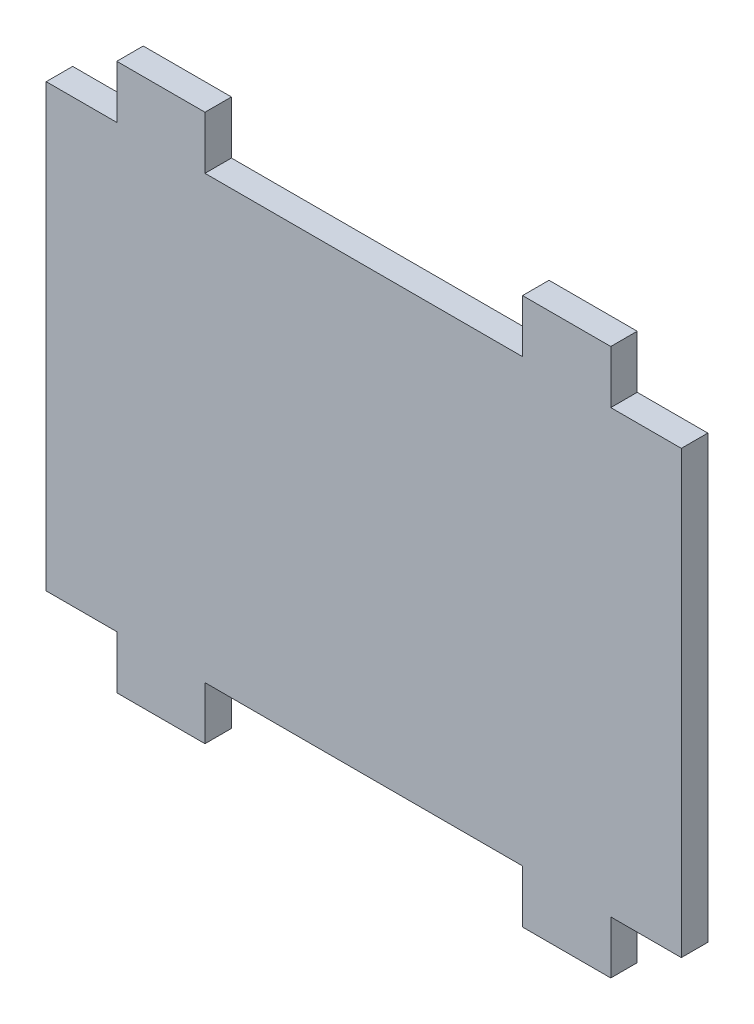
from build123d import *

# Parameters (mm, degrees)
ESQUISSE1_W        = 72
ESQUISSE1_H        = 50
BOSS_EXTRU_1_DEPTH = 3
ESQUISSE2_W        = 10
ESQUISSE2_H        = 6
BOSS_EXTRU_2_DEPTH = 3


with BuildPart() as part:
    # Esquisse1 → Boss.-Extru.1 (new body)
    with BuildSketch(Plane.XY):
        with Locations((-36, 25)):
            Rectangle(ESQUISSE1_W, ESQUISSE1_H)
    extrude(amount=BOSS_EXTRU_1_DEPTH)

    # Esquisse2 → Boss.-Extru.2 (add)
    with BuildSketch(Plane.XY.offset(3)):
        with Locations((-59, -3)):
            Rectangle(ESQUISSE2_W, ESQUISSE2_H)
        with Locations((-59, 53)):
            Rectangle(ESQUISSE2_W, ESQUISSE2_H)
        with Locations((-13, 53)):
            Rectangle(ESQUISSE2_W, ESQUISSE2_H)
        with Locations((-13, -3)):
            Rectangle(ESQUISSE2_W, ESQUISSE2_H)
    extrude(amount=-BOSS_EXTRU_2_DEPTH)


solid = part.part
